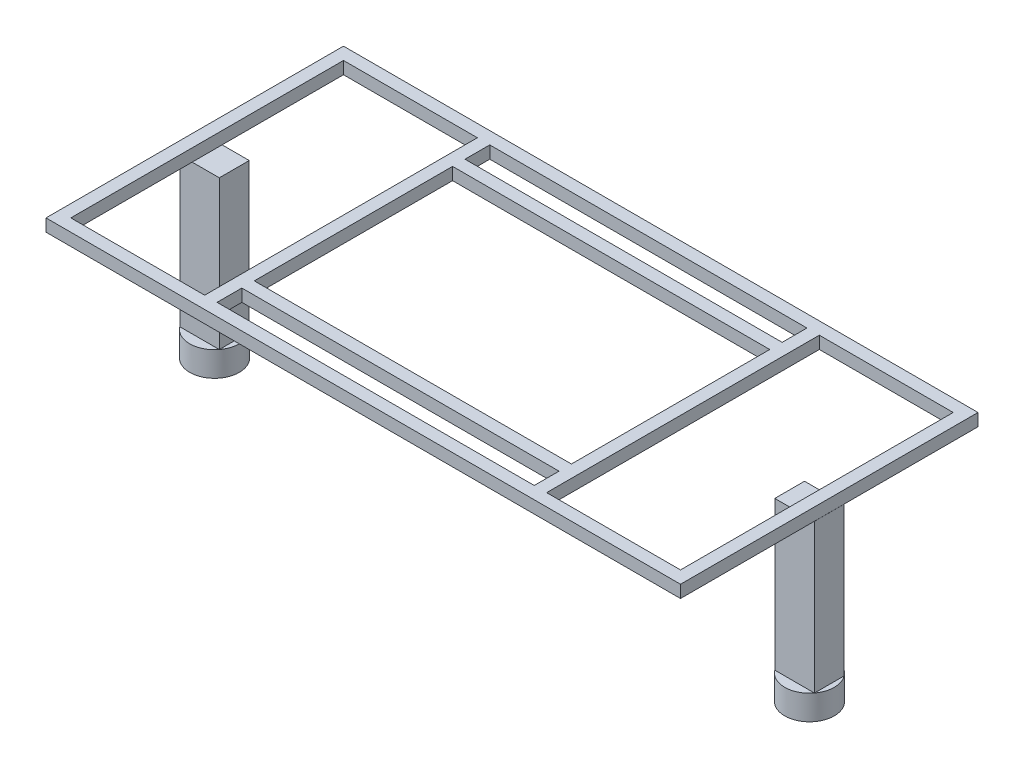
from build123d import *

# Parameters (mm, degrees)
SKETCH1_R             = 25.4
BOSS_EXTRUDE1_DEPTH   = 25.4
BOSS_EXTRUDE1_2_DEPTH = 25.4
SKETCH3_W             = 40.64380449
SKETCH3_H             = 30.474926688
BOSS_EXTRUDE2_DEPTH   = 152.4
SKETCH4_W             = 40.492338346
SKETCH4_H             = 30.67589502
BOSS_EXTRUDE3_DEPTH   = 152.4
SKETCH5_W             = 650.092338346
SKETCH5_H             = 304.8
SKETCH5_W_2           = 137.16
SKETCH5_H_2           = 279.4
SKETCH5_W_3           = 324.972338346
SKETCH5_H_3           = 25.4
SKETCH5_H_4           = 203.2
BOSS_EXTRUDE4_DEPTH   = 12.7


with BuildPart() as part:
    # Sketch1 → Boss-Extrude1 (new body)
    with BuildSketch(Plane(origin=(0, 0, 0), x_dir=(1, 0, 0), z_dir=(0, 1, 0))):
        with Locations(Location((304.8, 0, 0), (0, 0, 270))):
            Circle(SKETCH1_R)
    extrude(amount=BOSS_EXTRUDE1_DEPTH)

    # Sketch3 → Boss-Extrude2 (add)
    with BuildSketch(Plane(origin=(0, 25.4, 0), x_dir=(1, 0, 0), z_dir=(0, 1, 0))):
        with Locations((304.8, 0)):
            Rectangle(SKETCH3_W, SKETCH3_H)
    extrude(amount=BOSS_EXTRUDE2_DEPTH)



with BuildPart() as body_2:
    # Sketch1 → Boss-Extrude1 2 (new body)
    with BuildSketch(Plane(origin=(0, 0, 0), x_dir=(1, 0, 0), z_dir=(0, 1, 0))):
        with Locations(Location((-304.8, 0, 0), (0, 0, 270))):
            Circle(SKETCH1_R)
    extrude(amount=BOSS_EXTRUDE1_2_DEPTH)

    # Sketch4 → Boss-Extrude3 (add)
    with BuildSketch(Plane(origin=(0, 25.4, 0), x_dir=(1, 0, 0), z_dir=(0, 1, 0))):
        with Locations((-304.8, 0)):
            Rectangle(SKETCH4_W, SKETCH4_H)
    extrude(amount=BOSS_EXTRUDE3_DEPTH)


with BuildPart() as part_1:
    add(part.part)

    add(body_2.part)  # Boss-Extrude4 merges body 2
    # Sketch5 → Boss-Extrude4 (add)
    with BuildSketch(Plane(origin=(0, 177.8, 0), x_dir=(1, 0, 0), z_dir=(0, 1, 0))):
        Rectangle(SKETCH5_W, SKETCH5_H)
        with Locations((-243.766169173, 0)):
            Rectangle(SKETCH5_W_2, SKETCH5_H_2, mode=Mode.SUBTRACT)
        with Locations((243.766169173, 0)):
            Rectangle(SKETCH5_W_2, SKETCH5_H_2, mode=Mode.SUBTRACT)
        with Locations((0, 127)):
            Rectangle(SKETCH5_W_3, SKETCH5_H_3, mode=Mode.SUBTRACT)
        Rectangle(SKETCH5_W_3, SKETCH5_H_4, mode=Mode.SUBTRACT)
        with Locations((0, -127)):
            Rectangle(SKETCH5_W_3, SKETCH5_H_3, mode=Mode.SUBTRACT)
    extrude(amount=BOSS_EXTRUDE4_DEPTH)


solid = part_1.part
